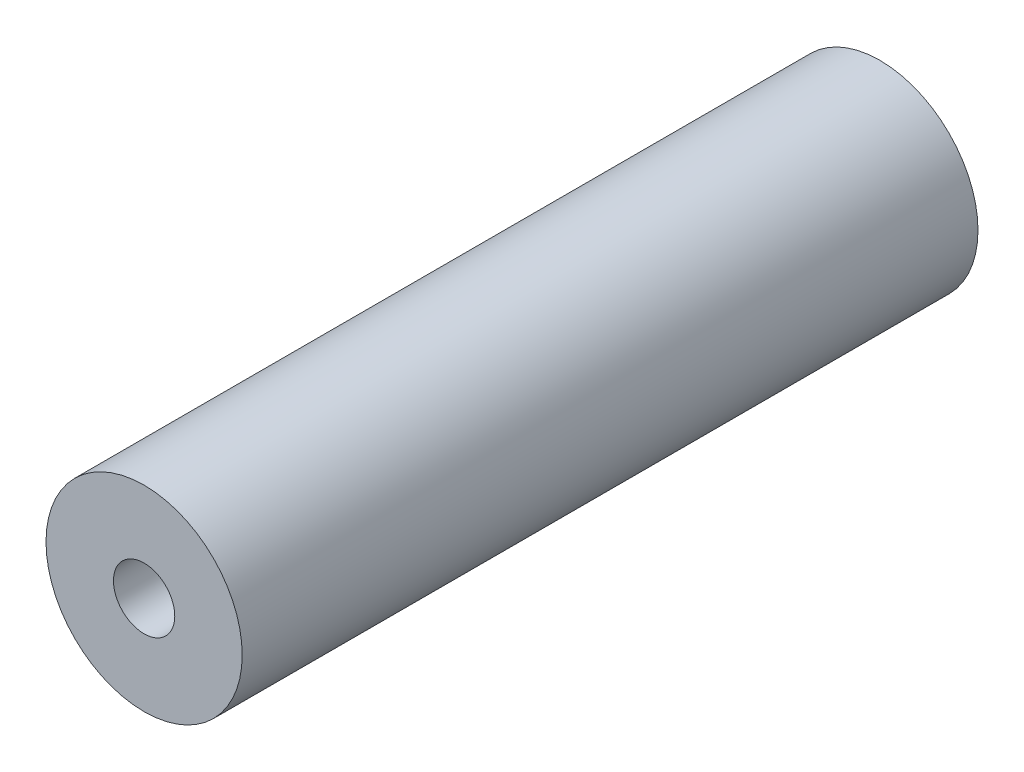
from build123d import *

# Parameters (mm, degrees)
SKETCH1_R           = 4
BOSS_EXTRUDE1_DEPTH = 15


with BuildPart() as part:
    # Sketch1 → Boss-Extrude1 (new, symmetric)
    with BuildSketch(Plane.XY):
        Circle(SKETCH1_R)
    extrude(amount=BOSS_EXTRUDE1_DEPTH, both=True)

    # Sketch3 → M3 Tapped Hole1 (revolve, cut)
    with BuildSketch(Plane(origin=(0, 0, 15), x_dir=(0, -1, 0), z_dir=(1, 0, 0))):
        Polygon((0, 0), (0, 8.251075774), (1.25, 7.5), (1.25, 0), align=None)
    m3_tapped_hole1 = revolve(axis=Axis((0, 0, 21.35), (0, 0, -1)), mode=Mode.SUBTRACT)

    # Mirror1: M3 Tapped Hole1 across plane
    add(m3_tapped_hole1.mirror(Plane.XY), mode=Mode.SUBTRACT)


solid = part.part
